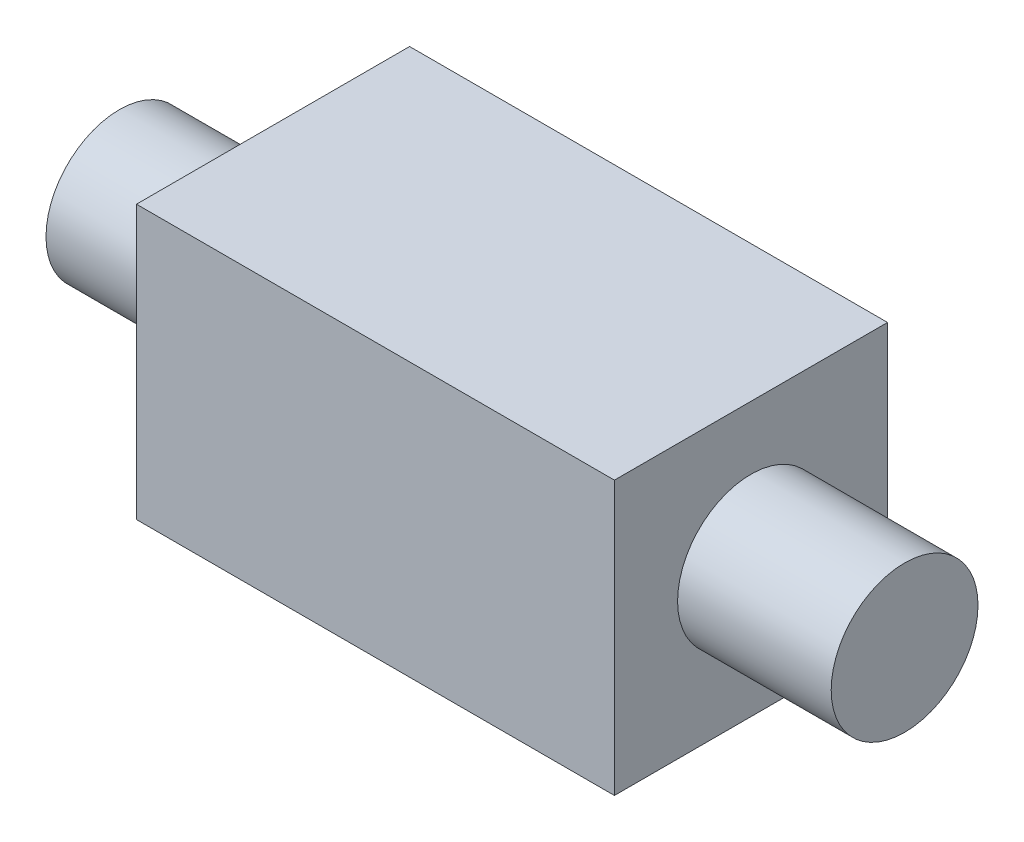
from build123d import *

# Parameters (mm, degrees)
SKETCH1_W           = 14
SKETCH1_H           = 8
BOSS_EXTRUDE1_DEPTH = 8
SKETCH3_R           = 2.15
BOSS_EXTRUDE3_DEPTH = 4.5
BOSS_EXTRUDE4_START = 4.5
SKETCH4_R           = 2.15
BOSS_EXTRUDE4_DEPTH = 4.5


with BuildPart() as part:
    # Sketch1 → Boss-Extrude1 (new body)
    with BuildSketch(Plane(origin=(0, 0, 0), x_dir=(1, 0, 0), z_dir=(0, 1, 0))):
        with Locations((17.805194805, 5.675324675)):
            Rectangle(SKETCH1_W, SKETCH1_H)
    extrude(amount=BOSS_EXTRUDE1_DEPTH)

    # Sketch3 → Boss-Extrude3 (add)
    with BuildSketch(Plane(origin=(24.805194805, 0, 0), x_dir=(0, 0, -1), z_dir=(1, 0, 0))):
        with Locations(Location((5.675324675, 4, 0), (0, 0, 180))):
            Circle(SKETCH3_R)
    extrude(amount=BOSS_EXTRUDE3_DEPTH)

    # Sketch4 → Boss-Extrude4 (add)
    with BuildSketch(Plane.ZY.offset(-10.805194805).offset(BOSS_EXTRUDE4_START)):
        with Locations((-5.675324675, 4)):
            Circle(SKETCH4_R)
    extrude(amount=-BOSS_EXTRUDE4_DEPTH)


solid = part.part
